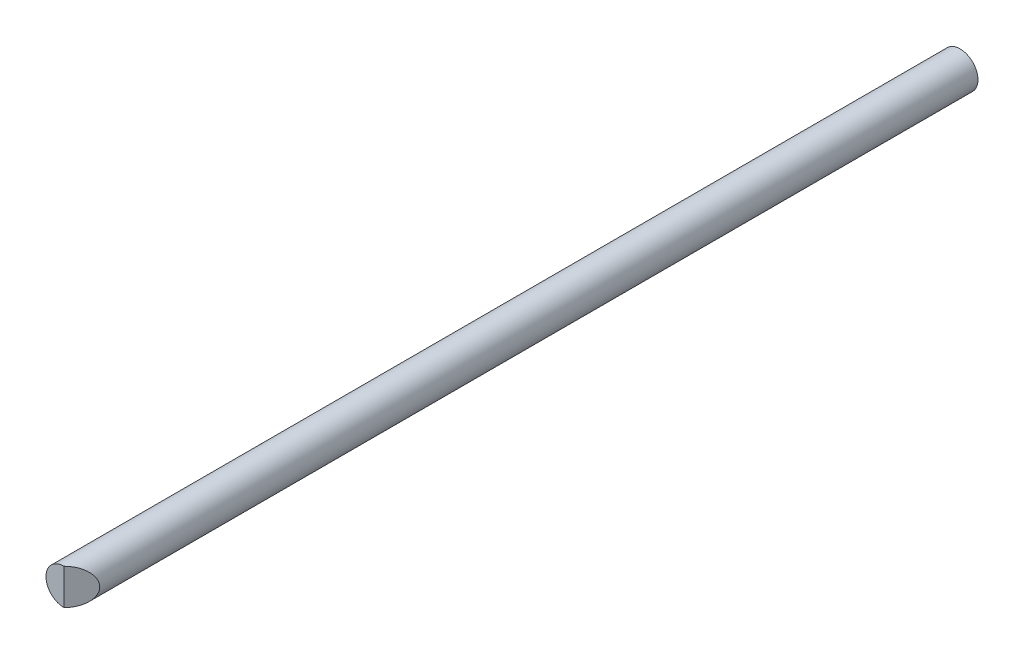
from build123d import *

# Parameters (mm, degrees)
SKETCH_1_R          = 0.5
EXTRUDE_1_DEPTH     = 25
CUT_EXTRUDE_1_DEPTH = 12.5


with BuildPart() as part:
    # 草图1 → 凸台-拉伸1 (new body)
    with BuildSketch(Plane.XY):
        Circle(SKETCH_1_R)
    extrude(amount=EXTRUDE_1_DEPTH)

    # 草图2 → 切除-拉伸1 (cut, symmetric)
    with BuildSketch(Plane(origin=(0, 0, 0), x_dir=(1, 0, 0), z_dir=(0, 1, 0))):
        Polygon((0, -25), (0.5, -24.5), (0.5, -25), align=None)
    extrude(amount=CUT_EXTRUDE_1_DEPTH, both=True, mode=Mode.SUBTRACT)


solid = part.part
